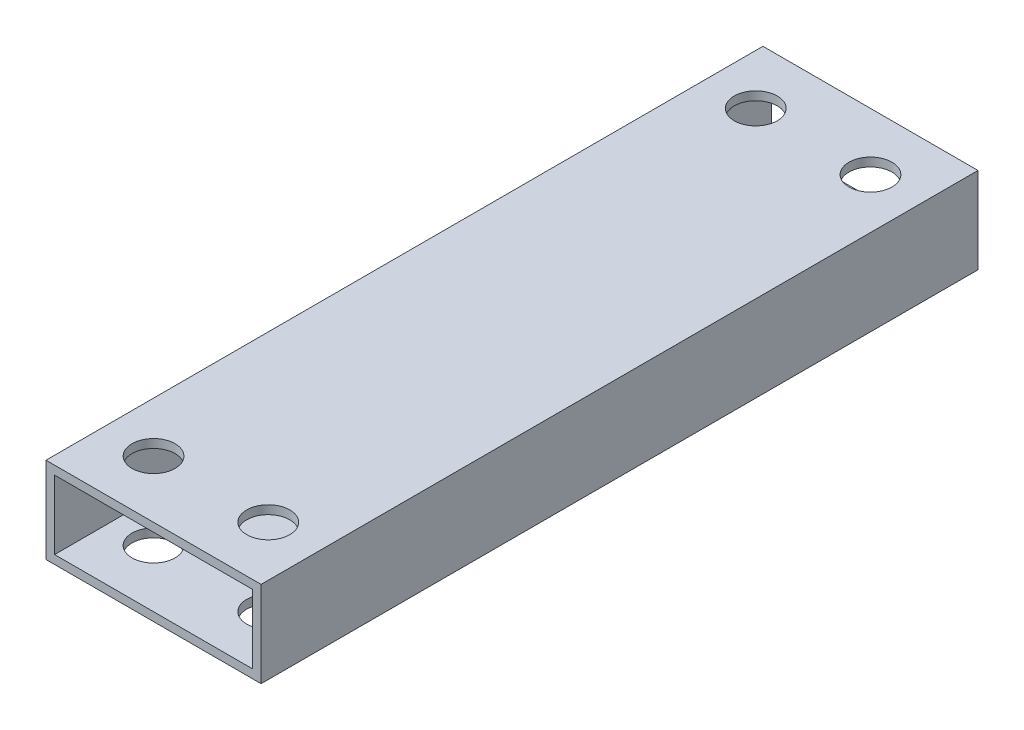
from build123d import *

# Parameters (mm, degrees)
SKETCH_2_W          = 15
SKETCH_2_H          = 6
SKETCH_2_W_2        = 13.8
SKETCH_2_H_2        = 4.8
EXTRUDE_1_DEPTH     = 50
SKETCH_3_R          = 1.5
CUT_EXTRUDE_1_DEPTH = 80


with BuildPart() as part:
    # 草图2 → 凸台-拉伸1 (new body)
    with BuildSketch(Plane.XY):
        Rectangle(SKETCH_2_W, SKETCH_2_H)
        Rectangle(SKETCH_2_W_2, SKETCH_2_H_2, mode=Mode.SUBTRACT)
    extrude(amount=EXTRUDE_1_DEPTH)

    # 草图3 → 切除-拉伸1 (cut)
    with BuildSketch(Plane(origin=(0, 3, 0), x_dir=(1, 0, 0), z_dir=(0, 1, 0))):
        with Locations(Location((-4, -4, 0), (0, 0, 270))):
            Circle(SKETCH_3_R)
        with Locations(Location((4, -4, 0), (0, 0, 270))):
            Circle(SKETCH_3_R)
        with Locations((4, -46)):
            Circle(SKETCH_3_R)
        with Locations((-4, -46)):
            Circle(SKETCH_3_R)
    extrude(amount=-CUT_EXTRUDE_1_DEPTH, mode=Mode.SUBTRACT)


solid = part.part
